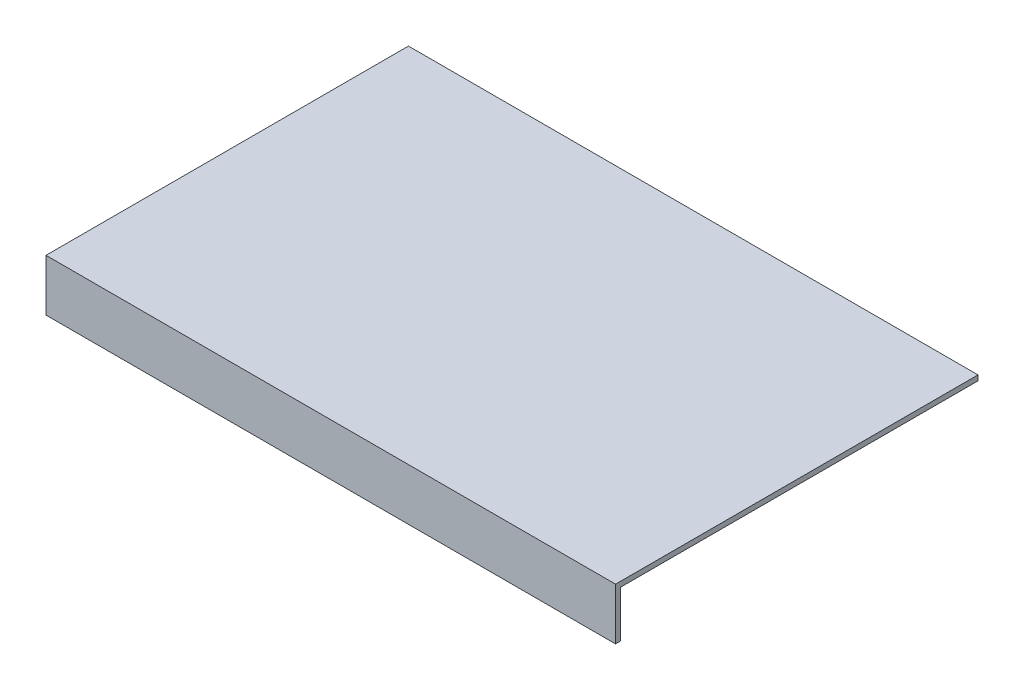
from build123d import *

# Parameters (mm, degrees)
BOSS_EXTRUDE1_DEPTH = 25.4
FILLET1_R           = 20.32
SHELL1_T            = -2.54
SKETCH2_R           = 2.54
CUT_EXTRUDE1_DEPTH  = 347.409815103
SKETCH3_R           = 2.54
CUT_EXTRUDE2_DEPTH  = 347.409815103


with BuildPart() as part:
    # Sketch1 → Boss-Extrude1 (new body)
    with BuildSketch(Plane(origin=(0, 0, 0), x_dir=(1, 0, 0), z_dir=(0, 1, 0))):
        Polygon((-279.4, 203.2), (-279.4, -203.2), (279.4, -203.2), (279.4, 203.2), (152.4, 203.2), (152.4, 12.7), (-152.4, 12.7), (-152.4, 203.2), align=None)
    extrude(amount=BOSS_EXTRUDE1_DEPTH)

    # Fillet1
    fillet1_edges = [part.edges().sort_by_distance(p)[0] for p in [
        (279.4, 12.7, -203.2),
        (-279.4, 12.7, -203.2),
        (-152.4, 12.7, -203.2),
        (152.4, 12.7, -203.2),
    ]]
    fillet(fillet1_edges, radius=FILLET1_R)

    # Shell1
    shell1_openings = [part.faces().sort_by_distance(p)[0] for p in [
        (0, 0, 37.577423361),
    ]]
    offset(amount=SHELL1_T, openings=shell1_openings, kind=Kind.INTERSECTION)

    # Sketch2 → Cut-Extrude1 (cut, through all)
    with BuildSketch(Plane(origin=(0, 25.4, 0), x_dir=(1, 0, 0), z_dir=(0, 1, 0))):
        with Locations(Location((-177.72, 165.1, 0), (0, 0, 270))):
            Circle(SKETCH2_R)
        with Locations(Location((-167.56, 165.1, 0), (0, 0, 270))):
            Circle(SKETCH2_R)
        with Locations(Location((167.56, 165.1, 0), (0, 0, 270))):
            Circle(SKETCH2_R)
        with Locations(Location((177.72, 165.1, 0), (0, 0, 270))):
            Circle(SKETCH2_R)
    extrude(amount=-CUT_EXTRUDE1_DEPTH, mode=Mode.SUBTRACT)

    # Sketch3 → Cut-Extrude2 (cut, through all)
    with BuildSketch(Plane(origin=(0, 25.4, 0), x_dir=(1, 0, 0), z_dir=(0, 1, 0))):
        with BuildLine():
            Line((-279.4, 182.88), (-279.4, -25.4))
            Line((-279.4, -25.4), (0, -25.4))
            Line((0, -25.4), (0, -203.2))
            Line((0, -203.2), (279.4, -203.2))
            Line((279.4, -203.2), (279.4, 182.88))
            ThreePointArc((279.4, 182.88), (273.448409794, 197.248409794), (259.08, 203.2))
            Line((259.08, 203.2), (172.72, 203.2))
            ThreePointArc((172.72, 203.2), (158.351590206, 197.248409794), (152.4, 182.88))
            Line((152.4, 182.88), (152.4, 12.7))
            Line((152.4, 12.7), (-152.4, 12.7))
            Line((-152.4, 12.7), (-152.4, 182.88))
            ThreePointArc((-152.4, 182.88), (-158.351590206, 197.248409794), (-172.72, 203.2))
            Line((-172.72, 203.2), (-259.08, 203.2))
            ThreePointArc((-259.08, 203.2), (-273.448409794, 197.248409794), (-279.4, 182.88))
        make_face()
        with Locations((-177.72, 165.1)):
            Circle(SKETCH3_R, mode=Mode.SUBTRACT)
        with Locations((-167.56, 165.1)):
            Circle(SKETCH3_R, mode=Mode.SUBTRACT)
        with Locations((167.56, 165.1)):
            Circle(SKETCH3_R, mode=Mode.SUBTRACT)
        with Locations((177.72, 165.1)):
            Circle(SKETCH3_R, mode=Mode.SUBTRACT)
    extrude(amount=-CUT_EXTRUDE2_DEPTH, mode=Mode.SUBTRACT)


solid = part.part
